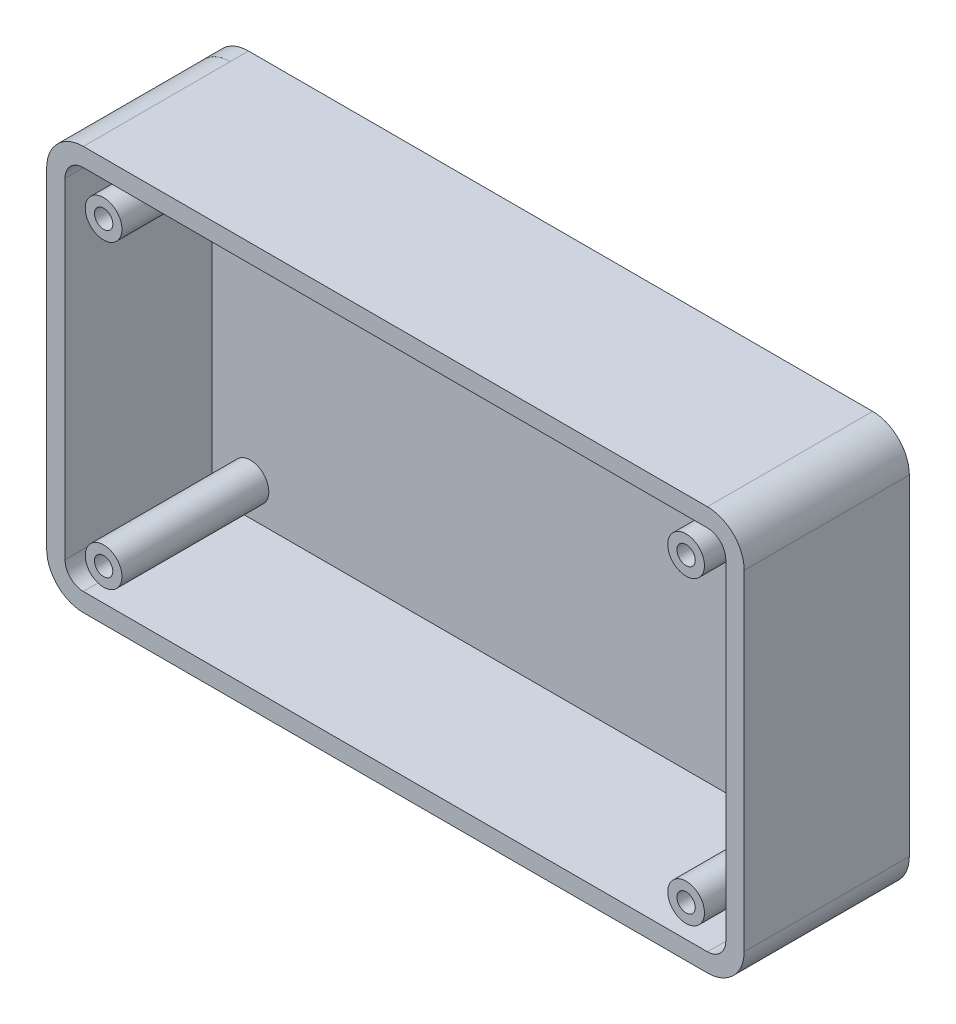
from build123d import *
from build123d.topology import SkipClean

# Parameters (mm, degrees)
BOSS_EXTRUDE1_DEPTH = 40
BOSS_EXTRUDE2_START = 5
BOSS_EXTRUDE2_DEPTH = 5
SKETCH4_R           = 5
SKETCH4_R_2         = 2.5
BOSS_EXTRUDE3_DEPTH = 40
CUT_EXTRUDE2_START  = -60
SKETCH5_R           = 2.5
SKETCH5_R_2         = 2.456644978
CUT_EXTRUDE2_DEPTH  = 60


with BuildPart() as part:
    # Sketch1 → Boss-Extrude1 (new body)
    with BuildSketch(Plane.XY):
        with BuildLine():
            Line((-95, -45), (-95, 45))
            ThreePointArc((-95, 45), (-92.071067812, 52.071067812), (-85, 55))
            Line((-85, 55), (85, 55))
            ThreePointArc((85, 55), (92.071067812, 52.071067812), (95, 45))
            Line((95, 45), (95, -45))
            ThreePointArc((95, -45), (92.071067812, -52.071067812), (85, -55))
            Line((85, -55), (-85, -55))
            ThreePointArc((-85, -55), (-92.071067812, -52.071067812), (-95, -45))
        make_face()
        with BuildLine():
            Line((-85, -50), (85, -50))
            ThreePointArc((85, -50), (88.535533906, -48.535533906), (90, -45))
            Line((90, -45), (90, 45))
            ThreePointArc((90, 45), (88.535533906, 48.535533906), (85, 50))
            Line((85, 50), (-85, 50))
            ThreePointArc((-85, 50), (-88.535533906, 48.535533906), (-90, 45))
            Line((-90, 45), (-90, -45))
            ThreePointArc((-90, -45), (-88.535533906, -48.535533906), (-85, -50))
        make_face(mode=Mode.SUBTRACT)
    extrude(amount=BOSS_EXTRUDE1_DEPTH)

    # Sketch3 → Boss-Extrude2 (add)
    with BuildSketch(Plane(origin=(0, 0, 0), x_dir=(-1, 0, 0), z_dir=(0, 0, -1)).offset(BOSS_EXTRUDE2_START)):
        with BuildLine():
            Line((-85, -55), (85.025805787, -55))
            ThreePointArc((85.025805787, -55), (92.096873598, -52.071067812), (95.025805787, -45))
            Line((95.025805787, -45), (95.025805787, 45))
            ThreePointArc((95.025805787, 45), (92.096873598, 52.071067812), (85.025805787, 55))
            Line((85.025805787, 55), (-85, 55))
            ThreePointArc((-85, 55), (-92.071067812, 52.071067812), (-95, 45))
            Line((-95, 45), (-95, -45))
            ThreePointArc((-95, -45), (-92.071067812, -52.071067812), (-85, -55))
        make_face()
    extrude(amount=-BOSS_EXTRUDE2_DEPTH)

    # Sketch4 → Boss-Extrude3 (add)
    # profile 1 of 4: a face of its own
    with BuildSketch(Plane.XY):
        with Locations(Location((-79.484929462, 40.691862401, 0), (0, 0, 180))):
            Circle(SKETCH4_R)
        with Locations((-79.484929462, 40.691862401)):
            Circle(SKETCH4_R_2, mode=Mode.SUBTRACT)
    # profile 2 of 4: a face of its own
    with BuildSketch(Plane.XY):
        with Locations(Location((-79.484929462, -41.238061896, 0), (0, 0, 180))):
            Circle(SKETCH4_R)
        with Locations((-79.484929462, -41.238061896)):
            Circle(SKETCH4_R_2, mode=Mode.SUBTRACT)
    # profile 3 of 4: a face of its own
    with BuildSketch(Plane.XY):
        with Locations(Location((79.186023927, -41.238061896, 0), (0, 0, 180))):
            Circle(SKETCH4_R)
        with Locations((79.186023927, -41.238061896)):
            Circle(SKETCH4_R_2, mode=Mode.SUBTRACT)
    # profile 4 of 4: a face of its own
    with BuildSketch(Plane.XY):
        with Locations(Location((79.186023927, 40.691862401, 0), (0, 0, 180))):
            Circle(SKETCH4_R)
        with Locations((79.186023927, 40.691862401)):
            Circle(SKETCH4_R_2, mode=Mode.SUBTRACT)
    extrude(amount=BOSS_EXTRUDE3_DEPTH)

    # Sketch5 → Cut-Extrude2 (cut)
    with SkipClean():  # the faces are left unmerged after this step: merging them gives an invalid solid
        with BuildSketch(Plane.XY.offset(40).offset(CUT_EXTRUDE2_START)):
            with Locations(Location((-79.484929462, 40.691862401, 0), (0, 0, 180))):
                Circle(SKETCH5_R)
            with Locations((79.186023927, 40.691862401)):
                Circle(SKETCH5_R_2)
            with Locations(Location((-79.484929462, -41.238061896, 0), (0, 0, 180))):
                Circle(SKETCH5_R)
            with Locations(Location((79.186023927, -41.238061896, 0), (0, 0, 180))):
                Circle(SKETCH5_R)
        extrude(amount=CUT_EXTRUDE2_DEPTH, mode=Mode.SUBTRACT)


solid = part.part
